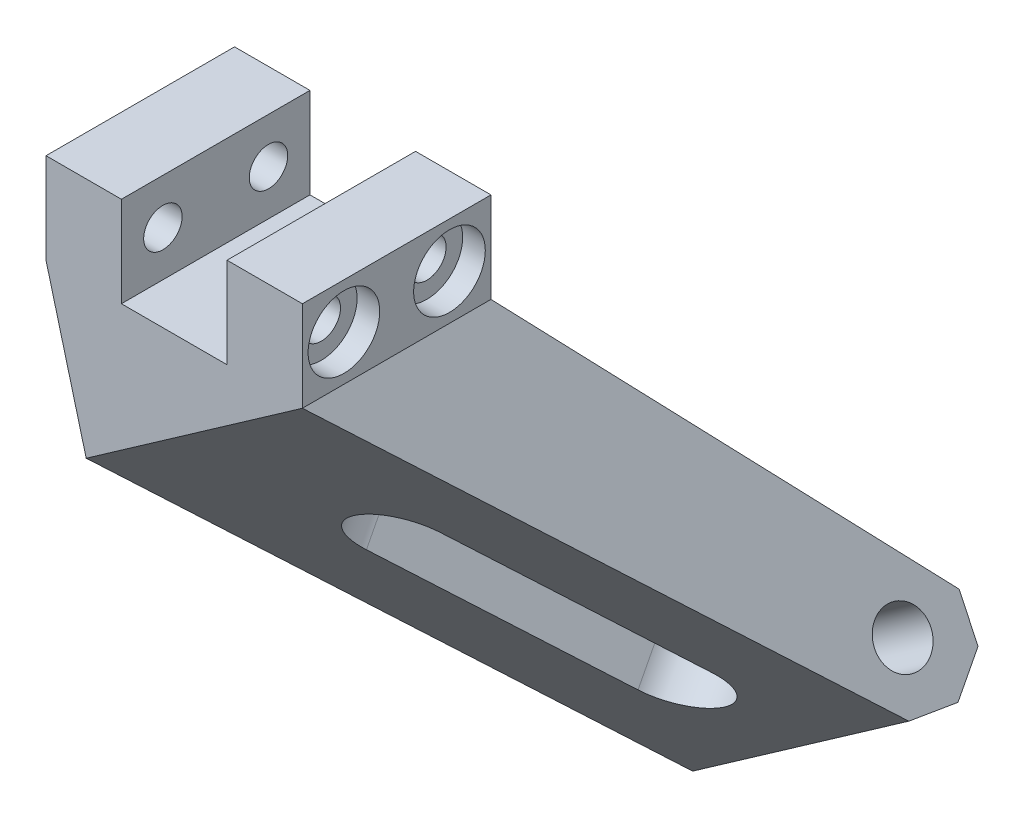
from build123d import *
from OCP.BRepFilletAPI import BRepFilletAPI_MakeChamfer

# Parameters (mm, degrees)
SKETCH_1_W               = 10
SKETCH_1_H               = 12
EXTRUDE_1_DEPTH          = 12.5
EXTRUDE_1_2_DEPTH        = 12.5
HOLE_WIZARD_1_AT_2_COUNT = 2
HOLE_WIZARD_1_AT_2_PITCH = 14
EXTRUDE_4_DEPTH          = 25
EXTRUDE_2_DEPTH          = 17.5
EXTRUDE_2_DEPTH_BACK     = 17.5
SKETCH_4_R               = 3.5
CUT_EXTRUDE_1_REACH      = 100.144
CHAMFER_1_SIZE           = 4
CHAMFER_1_SIZE2          = 4.335347702
HOLE_WIZARD_M3_1_D       = 2.5
HOLE_WIZARD_M3_1_DEPTH   = 8.5
HOLE_WIZARD_M3_1_TIP     = 0.751075774


with BuildPart() as part:
    # 草图1 → 凸台-拉伸1 (new, symmetric)
    with BuildSketch(Plane.XY):
        with Locations((12, 6)):
            Rectangle(SKETCH_1_W, SKETCH_1_H)
    extrude(amount=EXTRUDE_1_DEPTH, both=True)


with BuildPart() as body_2:
    # 草图1 → Extrude 1 2 (new, symmetric)
    with BuildSketch(Plane.XY):
        with Locations((-12, 6)):
            Rectangle(SKETCH_1_W, SKETCH_1_H)
    extrude(amount=EXTRUDE_1_2_DEPTH, both=True)


with BuildPart() as hole_wizard_1_tool:
    # 草图2 → 打孔尺寸(%根据)内六角圆柱头螺钉的类型1 (revolve)
    with BuildSketch(Plane(origin=(17, 6, -7), x_dir=(0, 0, -1), z_dir=(0, 1, 0))):
        Polygon((0, 0), (0, 34), (2.55, 34), (2.55, 3), (4.75, 3), (4.75, 0), align=None)
    hole_wizard_1 = revolve(axis=Axis((23.35, 6, -7), (-1, 0, 0)))


with BuildPart() as part_1:
    add(part.part)

    # 打孔尺寸(%根据)内六角圆柱头螺钉的类型1: cut by hole_wizard_1_tool
    add(hole_wizard_1_tool.part, mode=Mode.SUBTRACT)


with BuildPart() as body_2_1:
    add(body_2.part)

    # 打孔尺寸(%根据)内六角圆柱头螺钉的类型1: cut by hole_wizard_1_tool
    add(hole_wizard_1_tool.part, mode=Mode.SUBTRACT)


with BuildPart() as hole_wizard_1_at_2_tool:
    # 打孔尺寸(%根据)内六角圆柱头螺钉的类型1 at 2: 打孔尺寸(%根据)内六角圆柱头螺钉的类型1 ×2
    with Locations(*[(0, 0, i * HOLE_WIZARD_1_AT_2_PITCH) for i in range(1, HOLE_WIZARD_1_AT_2_COUNT)]):
        add(hole_wizard_1)


with BuildPart() as part_2:
    add(part_1.part)

    # 打孔尺寸(%根据)内六角圆柱头螺钉的类型1 at 2: cut by hole_wizard_1_at_2_tool
    add(hole_wizard_1_at_2_tool.part, mode=Mode.SUBTRACT)



with BuildPart() as body_2_2:
    add(body_2_1.part)

    # 打孔尺寸(%根据)内六角圆柱头螺钉的类型1 at 2: cut by hole_wizard_1_at_2_tool
    add(hole_wizard_1_at_2_tool.part, mode=Mode.SUBTRACT)


with BuildPart() as part_3:
    add(part_2.part)

    add(body_2_2.part)  # 凸台-拉伸4 merges body 2
    # 草图6 → 凸台-拉伸4 (add)
    with BuildSketch(Plane(origin=(0, 0, -12.5), x_dir=(-1, 0, 0), z_dir=(0, 0, -1))):
        Polygon((-17, 0), (17, 0), (11.67032155, -20.075175272), align=None)
    extrude(amount=-EXTRUDE_4_DEPTH)

    # 草图4 → 凸台-拉伸2 (add, two sides: drawn at the far end of the back side and taken through both)
    with BuildSketch(Plane(origin=(-7.685363659, 4.744033982, 0), x_dir=(0, 0, -1), z_dir=(-0.8191520442889951, -0.5735764363510414, 0)).offset(-EXTRUDE_2_DEPTH_BACK)):
        Polygon((12.5, 18.045028052), (50.539262654, 67.394660065), (39.451002702, 75.941618076), (-12.5, 18.045028052), align=None)
        with Locations(Location((39.84841247, 65.534516772, 0), (0, 0, 90))):
            Circle(SKETCH_4_R, mode=Mode.SUBTRACT)
    extrude(amount=EXTRUDE_2_DEPTH + EXTRUDE_2_DEPTH_BACK)

    # 切除-拉伸1: up to this plane
    cut_extrude_1_end = Plane(origin=(21.537798233, -67.501285348, -39.451002702), z_dir=(-0.3830667568209006, 0.5470760252029422, -0.7442900526453828))
    # 草图5 → 切除-拉伸1 (cut, up to the surface)
    with BuildSketch(Plane(origin=(-1.16889346, 1.604566704, -3.454039215), x_dir=(-0.9325122511072526, -0.10637169697175478, 0.34511731862981554), z_dir=(0.35016669411834533, -0.5000898662325965, 0.7920185679778556)), mode=Mode.PRIVATE) as cut_extrude_1_sk1:
        with BuildLine():
            Line((-24.709218078, 52.926133943), (-6.162290123, 25.862856448))
            ThreePointArc((-6.162290123, 25.862856448), (-7.719746755, 17.521733692), (-16.060869512, 19.079190323))
            Line((-16.060869512, 19.079190323), (-34.607797466, 46.142467818))
            ThreePointArc((-34.607797466, 46.142467818), (-33.050340834, 54.483590575), (-24.709218078, 52.926133943))
        make_face()
    cut_extrude_1_tool1 = split(extrude(cut_extrude_1_sk1.sketch, amount=CUT_EXTRUDE_1_REACH, mode=Mode.PRIVATE), bisect_by=cut_extrude_1_end, keep=Keep.BOTH, mode=Mode.PRIVATE)
    add(cut_extrude_1_tool1.solids().sort_by_distance((14.659887, -27.168291, -28.619771))[0], mode=Mode.SUBTRACT)

    # 倒角1: one chamfer whose edges measure the first distance from different faces: ONE call of the kernel's chamfer builder (chamfer() names one face for all edges)
    chamfer_1_edges_1 = [part_3.edges().sort_by_distance(p)[0] for p in [
        (30.97062529, -50.462439584, -50.539262654),
    ]]
    chamfer_1_edges_2 = [part_3.edges().sort_by_distance(p)[0] for p in [
        (35.872959008, -57.463697712, -39.451002702),
    ]]
    chamfer_1_side_2 = [part_3.faces().sort_by_distance(p)[0] for p in [
        (33.421792149, -53.963068648, -44.995132678),
    ]]
    chamfer_1 = BRepFilletAPI_MakeChamfer(part_3.part.solid().wrapped)
    for e in chamfer_1_edges_1:
        chamfer_1.Add(CHAMFER_1_SIZE, e.wrapped)
    for e in chamfer_1_edges_2:
        chamfer_1.Add(CHAMFER_1_SIZE, CHAMFER_1_SIZE2, e.wrapped, chamfer_1_side_2[0].wrapped)  # the first distance lies on this face
    add(Compound.cast(chamfer_1.Shape()), mode=Mode.REPLACE)

    # M3 螺纹孔1
    with Locations(Plane(origin=(-17.263150332, -12.087787996, 0), x_dir=(0, 0, 1), z_dir=(-0.819152044288995, -0.5735764363510415, 0))):
        with Locations((0.222978111, -12.58288498), (-5.787730476, -19.281495453)):
            Hole(HOLE_WIZARD_M3_1_D / 2, depth=HOLE_WIZARD_M3_1_DEPTH)
            with Locations((0, 0, -(HOLE_WIZARD_M3_1_DEPTH + HOLE_WIZARD_M3_1_TIP / 2))):  # 118° drill point
                Cone(0, HOLE_WIZARD_M3_1_D / 2, HOLE_WIZARD_M3_1_TIP, mode=Mode.SUBTRACT)


solid = part_3.part
